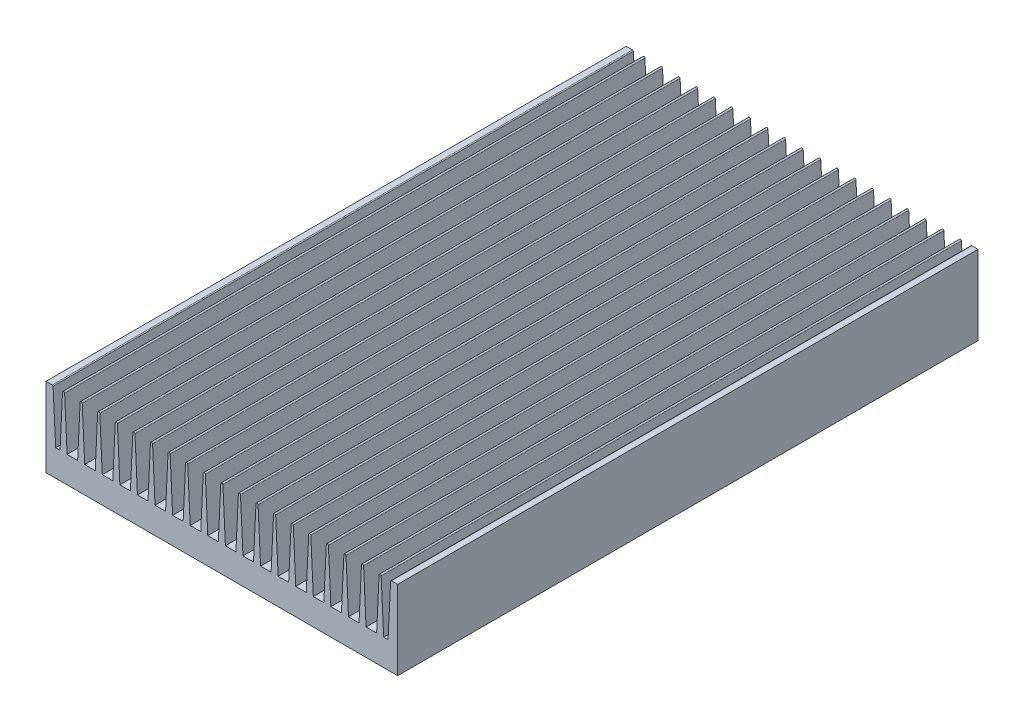
from build123d import *

# Parameters (mm, degrees)
EXTRUDE_1_DEPTH       = 330
EXTRUDE_3_DEPTH       = 330
PATTERN_CURVE_1_COUNT = 19
PATTERN_CURVE_1_PITCH = 10
SKETCH_3_R            = 2.1
SKETCH_3_R_2          = 2.6
SKETCH_3_R_3          = 1.6
SKETCH_3_R_4          = 1.3
CUT_EXTRUDE_1_DEPTH   = 8


with BuildPart() as part:
    # Эскиз1 → Вытянуть1 (new body)
    with BuildSketch(Plane.XY):
        with BuildLine():
            Line((0, 45), (3.52437539, 45))
            ThreePointArc((3.52437539, 45), (3.868987923, 44.862273656), (4.02375156, 44.524968808))
            Line((4.02375156, 44.524968808), (5.5, 15))
            Line((5.5, 15), (194.5, 15))
            Line((194.5, 15), (195.97624844, 44.524968808))
            ThreePointArc((195.97624844, 44.524968808), (196.131012077, 44.862273656), (196.47562461, 45))
            Line((196.47562461, 45), (200, 45))
            Line((200, 45), (200, 0))
            Line((200, 0), (0, 0))
            Line((0, 0), (0, 45))
        make_face()
    extrude(amount=EXTRUDE_1_DEPTH)

    # Эскиз2 → Вытянуть3 (add)
    with BuildSketch(Plane.XY.offset(330)):
        with BuildLine():
            Line((9.40067846, 44.428525275), (8, 15))
            Line((8, 15), (12, 15))
            Line((12, 15), (10.59932154, 44.428525275))
            ThreePointArc((10.59932154, 44.428525275), (10, 45), (9.40067846, 44.428525275))
        make_face()
    extrude_3 = extrude(amount=-EXTRUDE_3_DEPTH)

    # Кривая1: Вытянуть3 ×19
    with Locations(*[(i * PATTERN_CURVE_1_PITCH, 0, 0) for i in range(1, PATTERN_CURVE_1_COUNT)]):
        add(extrude_3)

    # Эскиз3 → Вырез-Вытянуть1 (cut)
    with BuildSketch(Plane.XZ):
        with Locations((9.5, 19.5)):
            Circle(SKETCH_3_R)
        with Locations((11.5, 151)):
            Circle(SKETCH_3_R)
        with Locations((16.5, 240)):
            Circle(SKETCH_3_R)
        with Locations((181.5, 210)):
            Circle(SKETCH_3_R)
        with Locations((188.5, 40)):
            Circle(SKETCH_3_R)
        with Locations((163.5, 130)):
            Circle(SKETCH_3_R)
        with Locations((63.5, 189)):
            Circle(SKETCH_3_R)
        with Locations((39.5, 79.5)):
            Circle(SKETCH_3_R_2)
        with Locations((114.5, 30)):
            Circle(SKETCH_3_R_3)
        with Locations((16.58, 183.75)):
            Circle(SKETCH_3_R_2)
        with Locations((84, 49)):
            Circle(SKETCH_3_R_4)
        with Locations((89, 89)):
            Circle(SKETCH_3_R_4)
        with Locations((61.5, 170)):
            Circle(SKETCH_3_R_4)
        with Locations((61.5, 210)):
            Circle(SKETCH_3_R_4)
        with Locations((108.5, 190)):
            Circle(SKETCH_3_R_4)
        with Locations((113.5, 220)):
            Circle(SKETCH_3_R)
    extrude(amount=-CUT_EXTRUDE_1_DEPTH, mode=Mode.SUBTRACT)


solid = part.part
